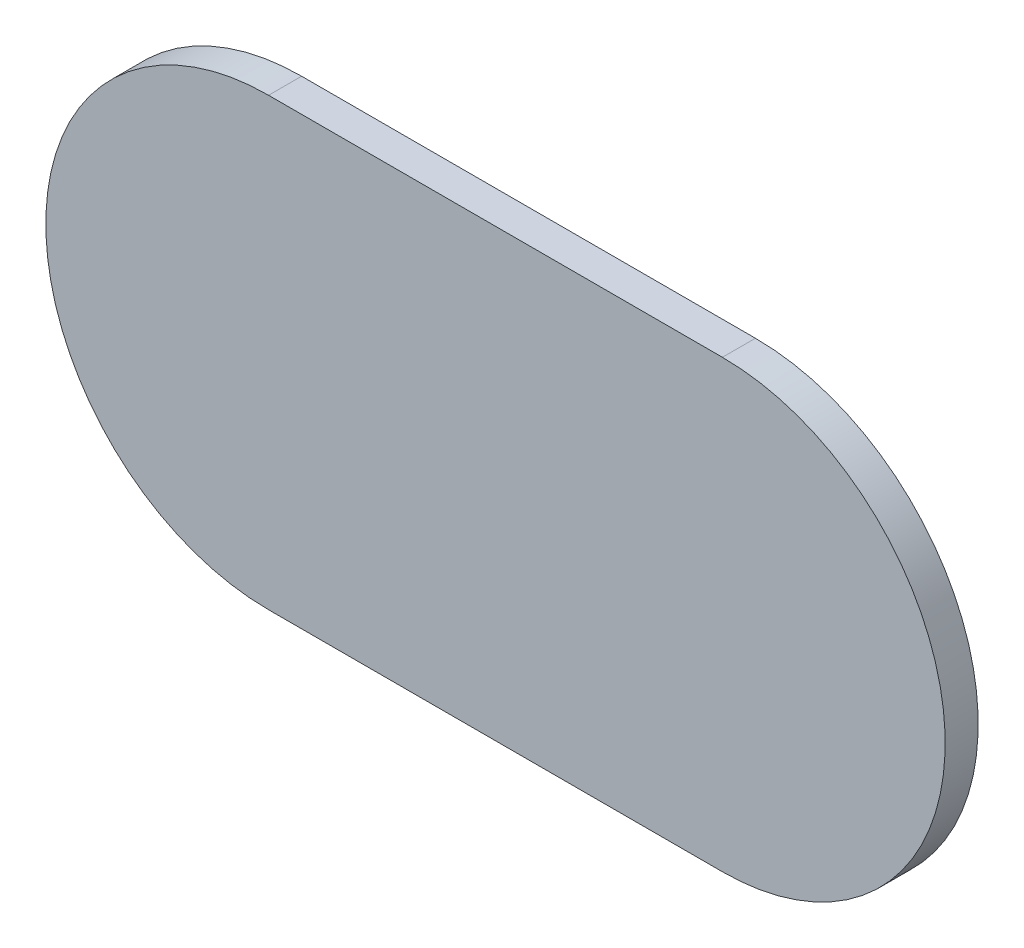
from build123d import *

# Parameters (mm, degrees)
BOSS_EXTRU_1_DEPTH = 0.4


with BuildPart() as part:
    # Esquisse1 → Boss.-Extru.1 (new body)
    with BuildSketch(Plane.XY):
        with BuildLine():
            Line((2.75, -2.7), (-2.75, -2.7))
            ThreePointArc((-2.75, -2.7), (-5.45, 0), (-2.75, 2.7))
            Line((-2.75, 2.7), (2.75, 2.7))
            ThreePointArc((2.75, 2.7), (5.45, 0), (2.75, -2.7))
        make_face()
    extrude(amount=BOSS_EXTRU_1_DEPTH)


solid = part.part
